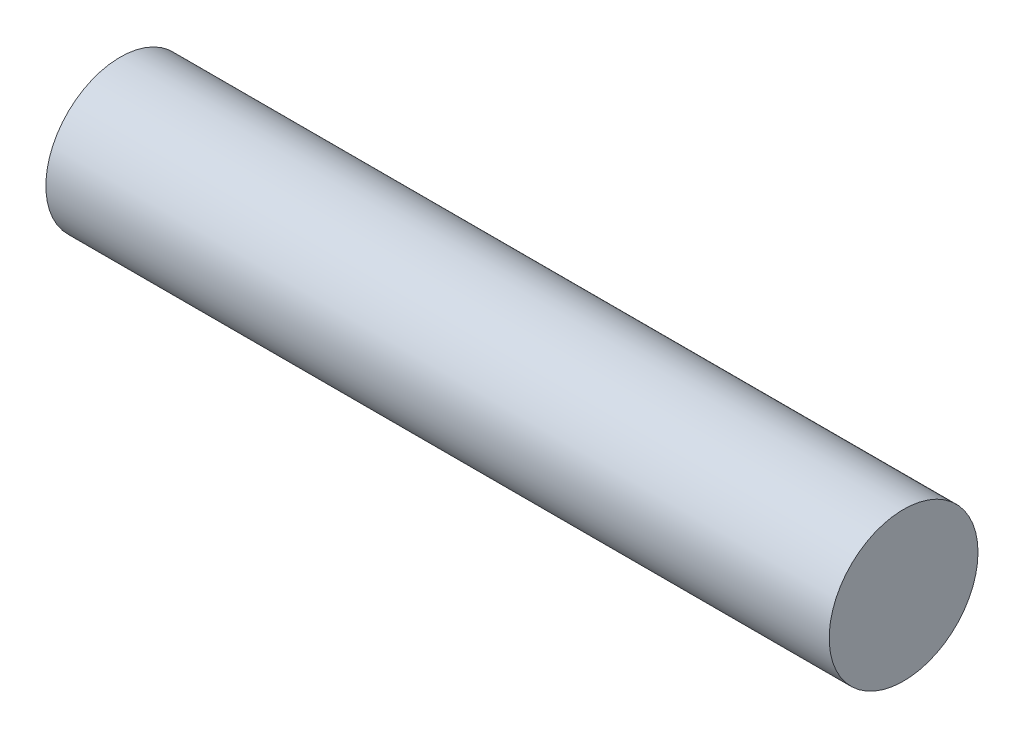
from build123d import *

# Parameters (mm, degrees)
SKETCH2_R           = 0.95
BOSS_EXTRUDE1_DEPTH = 10


with BuildPart() as part:
    # Sketch2 → Boss-Extrude1 (new body)
    with BuildSketch(Plane(origin=(0, 0, 0), x_dir=(0, 0, -1), z_dir=(1, 0, 0))):
        Circle(SKETCH2_R)
    extrude(amount=BOSS_EXTRUDE1_DEPTH)


solid = part.part
